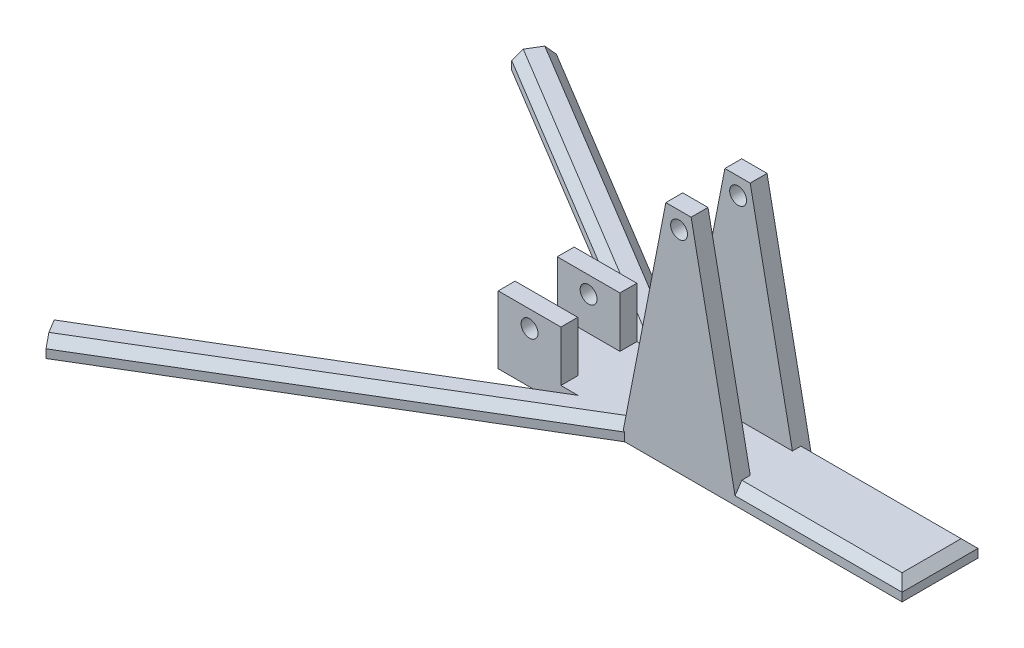
from build123d import *

# Parameters (mm, degrees)
ESQUISSE1_R             = 10
BOSS_EXTRU_1_DEPTH      = 20
BOSS_EXTRU_2_DEPTH      = 20
ESQUISSE3_R             = 10
BOSS_EXTRU_3_DEPTH      = 20
CHANFREIN3_SIZE         = 10
ESQUISSE2_5_W           = 74.303027804
ESQUISSE2_5_H           = 20
BOSS_EXTRU_4_DEPTH      = 60
ESQUISSE4_R             = 10
ENL_V_MAT_EXTRU_1_DEPTH = 831.815461604
CHANFREIN2_SIZE         = 10


with BuildPart() as part:
    # Esquisse1 → Boss.-Extru.1 (new body)
    with BuildSketch(Plane.XY):
        Polygon((455.162466111, 170), (485.162466111, 170), (535.244755063, -80), (406.445725989, -80), align=None)
        with Locations((470.845240526, 150)):
            Circle(ESQUISSE1_R, mode=Mode.SUBTRACT)
    extrude(amount=BOSS_EXTRU_1_DEPTH)

    # Esquisse2 → Boss.-Extru.2 (add)
    with BuildSketch(Plane.XZ.offset(80)):
        Polygon((735.244755063, 20), (406.445725989, 20), (-22.137924362, 277.519037455), (-42.004245202, 244.455927292), (331.553149283, 20), (256.445725989, 20), (256.445725989, -70), (331.553149283, -70), (-42.004245202, -294.455927292), (-22.137924362, -327.519037455), (406.445725989, -70), (735.244755063, -70), align=None)
    extrude(amount=BOSS_EXTRU_2_DEPTH)

    # Esquisse3 → Boss.-Extru.3 (add)
    with BuildSketch(Plane(origin=(0, 0, -70), x_dir=(-1, 0, 0), z_dir=(0, 0, -1))):
        Polygon((-406.445725989, -80), (-455.162466111, 170), (-485.162466111, 170), (-535.244755063, -80), align=None)
        with Locations((-470.845240526, 150)):
            Circle(ESQUISSE3_R, mode=Mode.SUBTRACT)
    extrude(amount=-BOSS_EXTRU_3_DEPTH)

    # Chanfrein3
    chanfrein3_edges = [part.edges().sort_by_distance(p)[0] for p in [
        (144.774452041, -80, 132.227963646),
        (144.774452041, -80, -182.227963646),
        (192.153900813, -80, 148.759518728),
        (192.153900813, -80, -198.759518728),
    ]]
    chamfer(chanfrein3_edges, length=CHANFREIN3_SIZE)

    # Esquisse2<5> → Boss.-Extru.4 (add)
    with BuildSketch(Plane.XZ.offset(80)):
        with Locations((293.597239891, 10)):
            Rectangle(ESQUISSE2_5_W, ESQUISSE2_5_H)
        with Locations((293.597239891, -60)):
            Rectangle(ESQUISSE2_5_W, ESQUISSE2_5_H)
    extrude(amount=-BOSS_EXTRU_4_DEPTH)

    # Esquisse4 → Enlèv. mat.-Extru.1 (cut, through all)
    with BuildSketch(Plane(origin=(0, 0, -70), x_dir=(-1, 0, 0), z_dir=(0, 0, -1))):
        with Locations((-293.597239891, -40)):
            Circle(ESQUISSE4_R)
    extrude(amount=-ENL_V_MAT_EXTRU_1_DEPTH, mode=Mode.SUBTRACT)

    # Chanfrein2
    chanfrein2_edges = [part.edges().sort_by_distance(p)[0] for p in [
        (635.244755063, -80, -70),
        (635.244755063, -80, 20),
        (735.244755063, -80, -25),
    ]]
    chamfer(chanfrein2_edges, length=CHANFREIN2_SIZE)


solid = part.part
